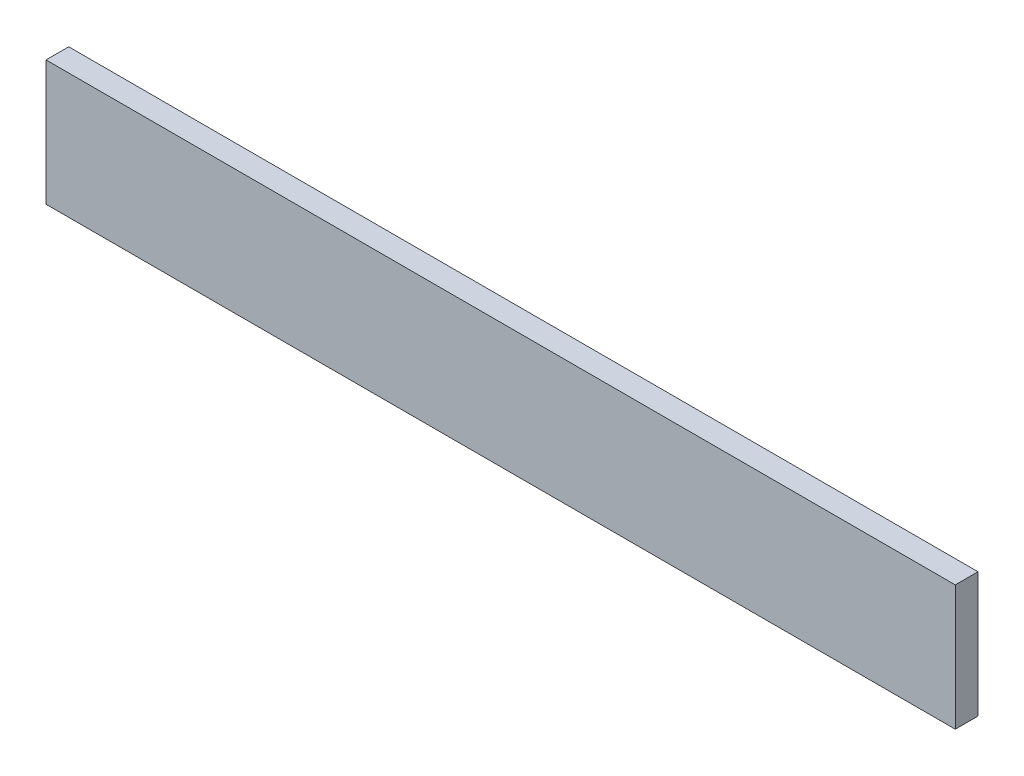
from build123d import *

# Parameters (mm, degrees)
ESQUISSE1_W        = 80
ESQUISSE1_H        = 11
BOSS_EXTRU_1_DEPTH = 2


with BuildPart() as part:
    # Esquisse1 → Boss.-Extru.1 (new body)
    with BuildSketch(Plane.XY):
        with Locations((40, 5.5)):
            Rectangle(ESQUISSE1_W, ESQUISSE1_H)
    extrude(amount=BOSS_EXTRU_1_DEPTH)


solid = part.part
